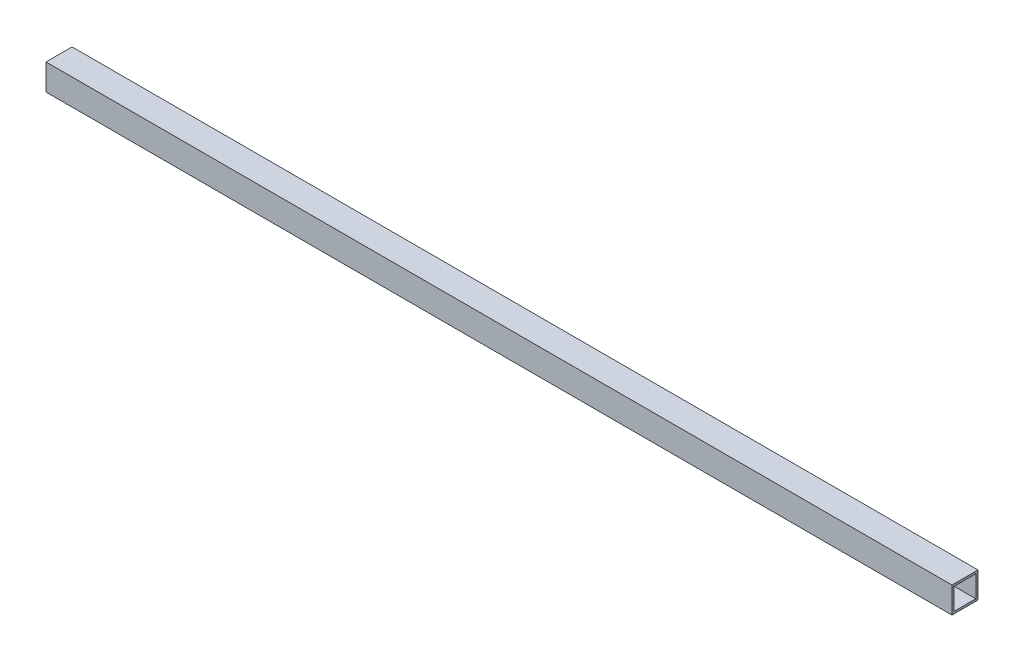
from build123d import *

# Parameters (mm, degrees)
SKETCH1_W           = 19.05
SKETCH1_H           = 19.05
SKETCH1_W_2         = 15.875
SKETCH1_H_2         = 15.875
BOSS_EXTRUDE1_DEPTH = 661.9


with BuildPart() as part:
    # Sketch1 → Boss-Extrude1 (new body)
    with BuildSketch(Plane(origin=(-989.493696964, 0, 0), x_dir=(0, 0, -1), z_dir=(1, 0, 0))):
        with Locations((-760.107848365, 71.368450435)):
            Rectangle(SKETCH1_W, SKETCH1_H)
        with Locations((-760.107848365, 71.368450435)):
            Rectangle(SKETCH1_W_2, SKETCH1_H_2, mode=Mode.SUBTRACT)
    extrude(amount=BOSS_EXTRUDE1_DEPTH)


solid = part.part
